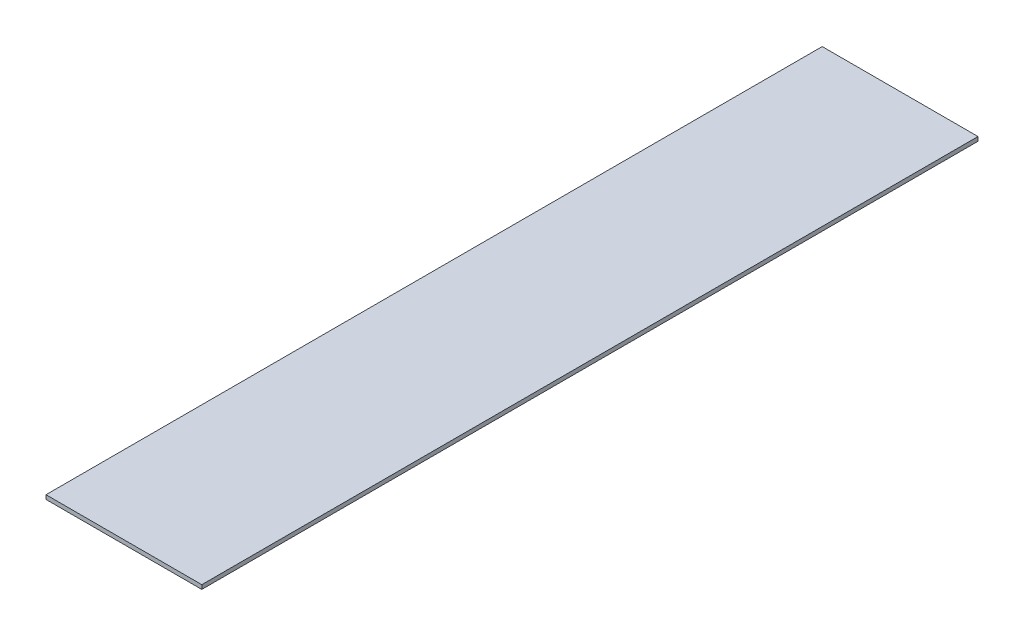
from build123d import *

# Parameters (mm, degrees)
SKETCH1_W           = 113
SKETCH1_H           = 563
BOSS_EXTRUDE1_DEPTH = 3


with BuildPart() as part:
    # Sketch1 → Boss-Extrude1 (new body)
    with BuildSketch(Plane(origin=(0, 0, 0), x_dir=(1, 0, 0), z_dir=(0, 1, 0))):
        with Locations((56.5, 281.5)):
            Rectangle(SKETCH1_W, SKETCH1_H)
    extrude(amount=BOSS_EXTRUDE1_DEPTH)


solid = part.part
